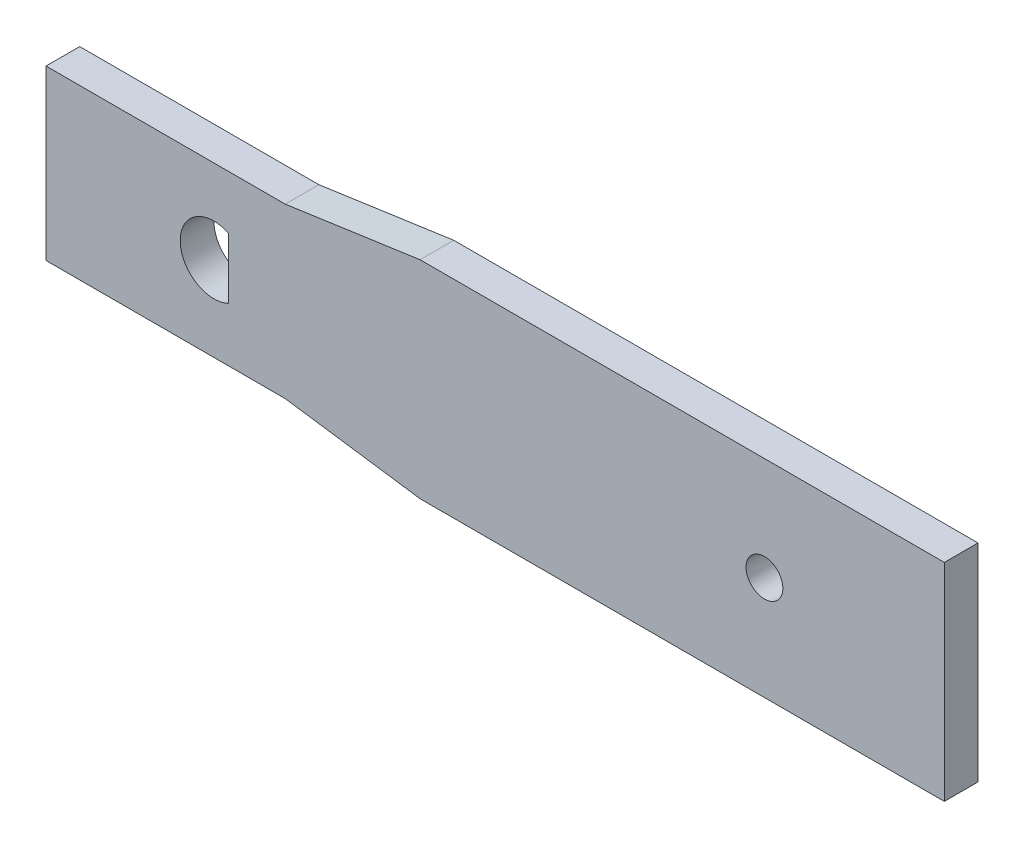
from build123d import *

# Parameters (mm, degrees)
BOSS_EXTRUDE1_DEPTH = 3
CUT_EXTRUDE3_DEPTH  = 516.692890771
SKETCH4_R           = 1.64
CUT_EXTRUDE2_DEPTH  = 516.692890771


with BuildPart() as part:
    # Sketch1 → Boss-Extrude1 (new body)
    with BuildSketch(Plane.XY):
        Polygon((-398.2841, 298.0765), (-386.271234014, 299.794262601), (-339.587365996, 299.794262601), (-339.587365996, 281.358737399), (-386.271234014, 281.358737399), (-398.2841, 283.0765), (-419.587365996, 283.0765), (-419.587365996, 298.0765), align=None)
    extrude(amount=BOSS_EXTRUDE1_DEPTH)

    # Sketch5 → Cut-Extrude3 (cut, through all)
    with BuildSketch(Plane(origin=(0, 0, 0), x_dir=(-1, 0, 0), z_dir=(0, 0, -1))):
        with BuildLine():
            Line((403.321087066, 293.299611149), (403.321087066, 287.899611149))
            ThreePointArc((403.321087066, 287.899611149), (407.635649248, 290.599611149), (403.321087066, 293.299611149))
        make_face()
    extrude(amount=-CUT_EXTRUDE3_DEPTH, mode=Mode.SUBTRACT)

    # Sketch4 → Cut-Extrude2 (cut, through all)
    with BuildSketch(Plane(origin=(0, 0, 0), x_dir=(-1, 0, 0), z_dir=(0, 0, -1))):
        with Locations((355.605649248, 290.599611149)):
            Circle(SKETCH4_R)
    extrude(amount=-CUT_EXTRUDE2_DEPTH, mode=Mode.SUBTRACT)


solid = part.part
